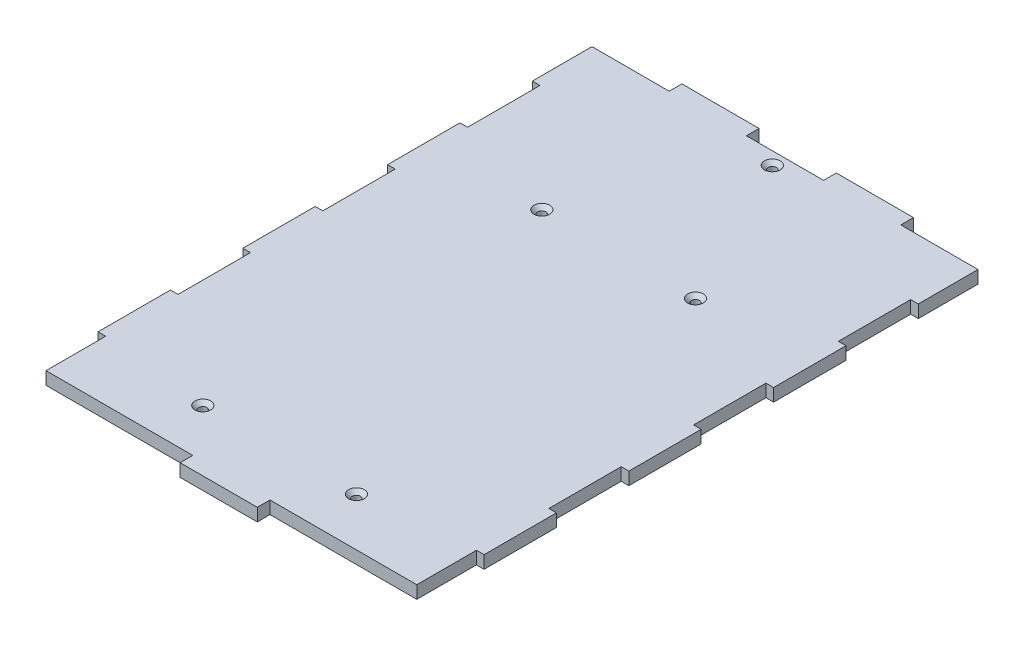
from build123d import *

# Parameters (mm, degrees)
BOSS_EXTRUDE1_DEPTH = 5
SKETCH2_R           = 1.6
CUT_EXTRUDE1_DEPTH  = 138.102151697
SKETCH3_R           = 1.6
CUT_EXTRUDE2_DEPTH  = 138.102151697
CHAMFER1_SIZE       = 1.5


with BuildPart() as part:
    # Sketch1 → Boss-Extrude1 (new body)
    with BuildSketch(Plane(origin=(0, 0, 0), x_dir=(1, 0, 0), z_dir=(0, 1, 0))):
        Polygon((0, -114), (-15.2, -114), (-15.2, -109), (-73, -109), (-73, -85.5), (-76, -85.5), (-76, -57), (-73, -57), (-73, -28.5), (-76, -28.5), (-76, 0), (-73, 0), (-73, 28.5), (-76, 28.5), (-76, 57), (-73, 57), (-73, 85.5), (-76, 85.5), (-76, 109), (-45.6, 109), (-45.6, 114), (-15.2, 114), (-15.2, 109), (0, 109), align=None)
    boss_extrude1 = extrude(amount=BOSS_EXTRUDE1_DEPTH)

    # Mirror1: Boss-Extrude1 across plane
    add(boss_extrude1.mirror(Plane(origin=(0, 5, 0), x_dir=(0, 0, 1), z_dir=(1, 0, 0))))

    # Sketch2 → Cut-Extrude1 (cut, through all)
    with BuildSketch(Plane(origin=(0, 5, 0), x_dir=(1, 0, 0), z_dir=(0, 1, 0))):
        with Locations(Location((0, 104, 0), (0, 0, 270))):
            Circle(SKETCH2_R)
    extrude(amount=-CUT_EXTRUDE1_DEPTH, mode=Mode.SUBTRACT)

    # Sketch3 → Cut-Extrude2 (cut, through all)
    with BuildSketch(Plane(origin=(0, 5, 0), x_dir=(1, 0, 0), z_dir=(0, 1, 0))):
        with Locations(Location((-30.25, -90, 0), (0, 0, 270))):
            Circle(SKETCH3_R)
        with Locations(Location((-30.25, 43.5, 0), (0, 0, 270))):
            Circle(SKETCH3_R)
        with Locations(Location((30.25, 43.5, 0), (0, 0, 270))):
            Circle(SKETCH3_R)
        with Locations(Location((30.25, -90, 0), (0, 0, 270))):
            Circle(SKETCH3_R)
    extrude(amount=-CUT_EXTRUDE2_DEPTH, mode=Mode.SUBTRACT)

    # Chamfer1
    chamfer1_edges = [part.edges().sort_by_distance(p)[0] for p in [
        (0, 5, -105.6),
        (30.25, 5, 88.4),
        (30.25, 5, -45.1),
        (-30.25, 5, -45.1),
        (-30.25, 5, 88.4),
    ]]
    chamfer(chamfer1_edges, length=CHAMFER1_SIZE)


solid = part.part
